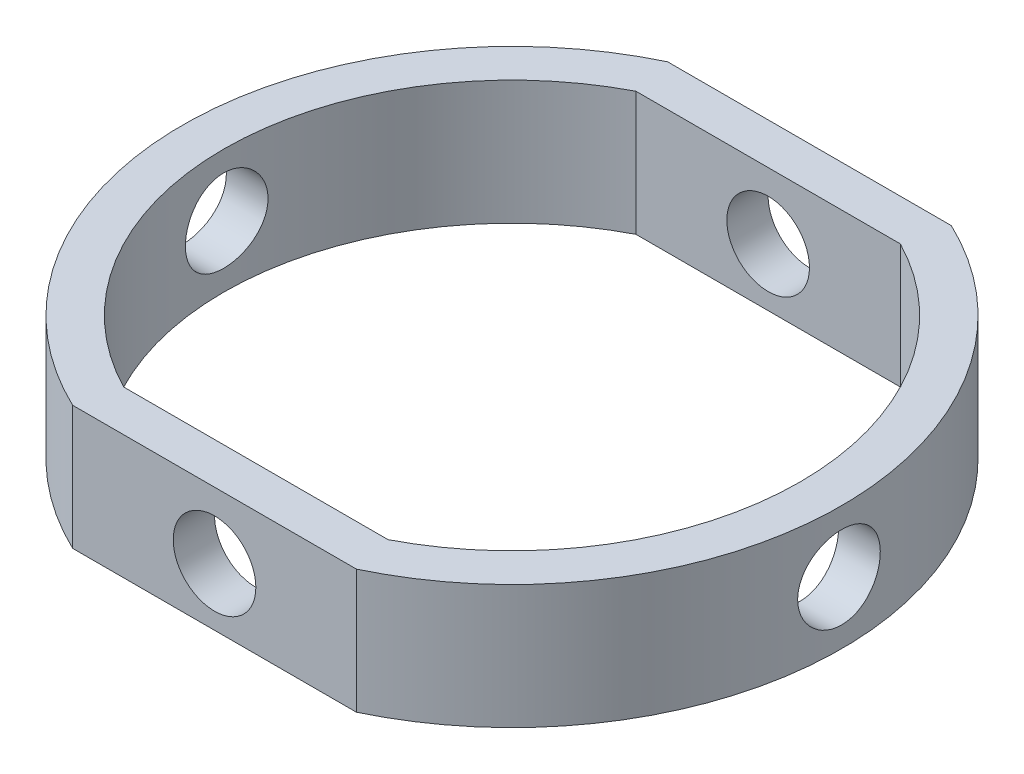
from build123d import *

# Parameters (mm, degrees)
BOSS_EXTRUDE1_DEPTH     = 7.5
CUT_EXTRUDE1_REACH      = 84.651
SKETCH2_R               = 5
CUT_EXTRUDE2_REACH      = 89.839
CUT_EXTRUDE2_END_RADIUS = 39.885527085
SKETCH3_R               = 5


with BuildPart() as part:
    # Sketch1 → Boss-Extrude1 (new, symmetric)
    with BuildSketch(Plane(origin=(0, 0, 0), x_dir=(1, 0, 0), z_dir=(0, 1, 0))):
        with BuildLine():
            Line((-17.171350292, -36), (17.171350292, -36))
            ThreePointArc((17.171350292, -36), (39.885527085, 0), (17.171350292, 36))
            Line((17.171350292, 36), (-17.171350292, 36))
            ThreePointArc((-17.171350292, 36), (-39.885527085, 0), (-17.171350292, -36))
        make_face()
        with BuildLine():
            Line((-16, 31), (16, 31))
            ThreePointArc((16, 31), (34.885527085, 0), (16, -31))
            Line((16, -31), (-16, -31))
            ThreePointArc((-16, -31), (-34.885527085, 0), (-16, 31))
        make_face(mode=Mode.SUBTRACT)
    extrude(amount=BOSS_EXTRUDE1_DEPTH, both=True)

    # Cut-Extrude1: up to this face of the body (flat: up to its plane)
    cut_extrude1_end = Plane(part.part.faces().sort_by_distance((0, 0, -36))[0])
    # Sketch2 → Cut-Extrude1 (cut, up to the picked face)
    with BuildSketch(Plane.XY.offset(36), mode=Mode.PRIVATE) as cut_extrude1_sk1:
        with Locations((0, -0.5)):
            Circle(SKETCH2_R)
    cut_extrude1_tool1 = split(extrude(cut_extrude1_sk1.sketch, amount=-CUT_EXTRUDE1_REACH, mode=Mode.PRIVATE), bisect_by=cut_extrude1_end, keep=Keep.BOTH, mode=Mode.PRIVATE)
    add(cut_extrude1_tool1.solids().sort_by(Axis((0, -0.5, 36), (0, 0, -1)))[0], mode=Mode.SUBTRACT)

    # Cut-Extrude2: up to this cylinder (the profile starts inside it)
    cut_extrude2_end = Plane(origin=(0, 0, 0), z_dir=(0, -1, 0)) * Cylinder(CUT_EXTRUDE2_END_RADIUS, 260.44905417, mode=Mode.PRIVATE)
    # Sketch3 → Cut-Extrude2 (cut, up to the surface)
    with BuildSketch(Plane.ZY.offset(39.885527085), mode=Mode.PRIVATE) as cut_extrude2_sk1:
        Circle(SKETCH3_R)
    cut_extrude2_tool1 = extrude(cut_extrude2_sk1.sketch, amount=-CUT_EXTRUDE2_REACH, mode=Mode.PRIVATE) & cut_extrude2_end
    add(cut_extrude2_tool1.solids().sort_by_distance((-39.885527, 0, 0))[0], mode=Mode.SUBTRACT)


solid = part.part
